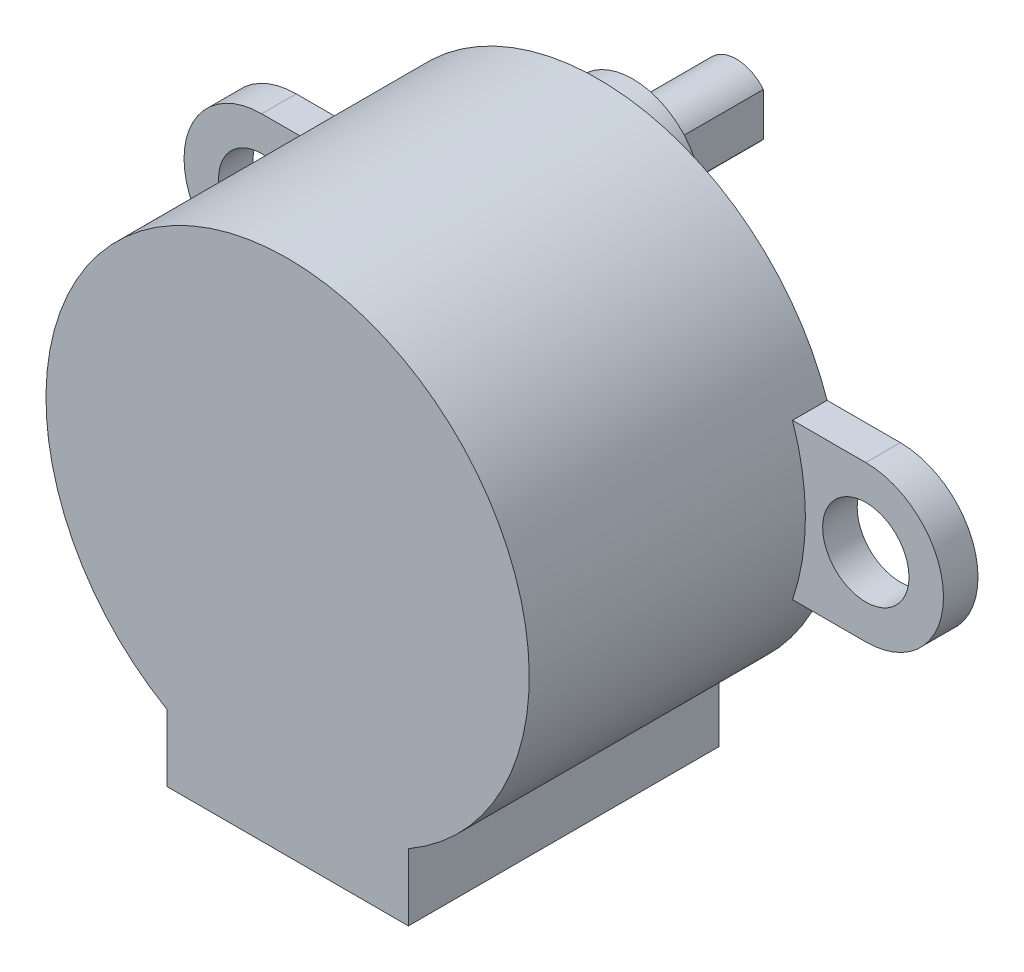
from build123d import *

# Parameters (mm, degrees)
CROQUIS1_R              = 14
SALIENTE_EXTRUIR1_DEPTH = 18
CROQUIS2_R              = 2.5
SALIENTE_EXTRUIR3_DEPTH = 2
SALIENTE_EXTRUIR4_DEPTH = 2
SALIENTE_EXTRUIR5_DEPTH = 6


with BuildPart() as part:
    # Croquis1 → Saliente-Extruir1 (new body)
    with BuildSketch(Plane.XY):
        Circle(CROQUIS1_R)
        with BuildLine():
            ThreePointArc((7, -12.124355653), (3.623466631, -13.522961568), (0, -14))
            Line((0, -14), (0, -16))
            Line((0, -16), (7, -16))
            Line((7, -16), (7, -12.124355653))
        make_face()
        with BuildLine():
            Line((0, -16), (0, -14))
            ThreePointArc((0, -14), (-3.623466631, -13.522961568), (-7, -12.124355653))
            Line((-7, -12.124355653), (-7, -16))
            Line((-7, -16), (0, -16))
        make_face()
    extrude(amount=SALIENTE_EXTRUIR1_DEPTH)

    # Croquis2 → Saliente-Extruir3 (add)
    # profile 1 of 2: a face of its own
    with BuildSketch(Plane(origin=(0, 0, 0), x_dir=(-1, 0, 0), z_dir=(0, 0, -1))):
        with BuildLine():
            Line((-17.5, 4.5), (-13.257073584, 4.5))
            ThreePointArc((-13.257073584, 4.5), (-14, 0), (-13.257073584, -4.5))
            Line((-13.257073584, -4.5), (-17.5, -4.5))
            ThreePointArc((-17.5, -4.5), (-22, 0), (-17.5, 4.5))
        make_face()
        with Locations((-17.5, 0)):
            Circle(CROQUIS2_R, mode=Mode.SUBTRACT)
    # profile 2 of 2: a face of its own
    with BuildSketch(Plane(origin=(0, 0, 0), x_dir=(-1, 0, 0), z_dir=(0, 0, -1))):
        with BuildLine():
            Line((17.5, -4.5), (13.257073584, -4.5))
            ThreePointArc((13.257073584, -4.5), (14, 0), (13.257073584, 4.5))
            Line((13.257073584, 4.5), (17.5, 4.5))
            ThreePointArc((17.5, 4.5), (22, 0), (17.5, -4.5))
        make_face()
        with Locations((17.5, 0)):
            Circle(CROQUIS2_R, mode=Mode.SUBTRACT)
    extrude(amount=-SALIENTE_EXTRUIR3_DEPTH)

    # Croquis3 → Saliente-Extruir4 (add)
    with BuildSketch(Plane(origin=(0, 0, 0), x_dir=(-1, 0, 0), z_dir=(0, 0, -1))):
        with BuildLine():
            ThreePointArc((4, 9), (2.828427125, 11.828427125), (0, 13))
            Line((0, 13), (0, 5))
            ThreePointArc((0, 5), (2.828427125, 6.171572875), (4, 9))
        make_face()
        with BuildLine():
            Line((0, 5), (0, 13))
            ThreePointArc((0, 13), (-4, 9), (0, 5))
        make_face()
    extrude(amount=SALIENTE_EXTRUIR4_DEPTH)

    # Croquis4 → Saliente-Extruir5 (add)
    with BuildSketch(Plane(origin=(0, 0, -2), x_dir=(-1, 0, 0), z_dir=(0, 0, -1))):
        with BuildLine():
            ThreePointArc((1.5612495, 10.25), (0, 11), (-1.5612495, 10.25))
            Line((-1.5612495, 10.25), (-1.5612495, 7.75))
            ThreePointArc((-1.5612495, 7.75), (0, 7), (1.5612495, 7.75))
            Line((1.5612495, 7.75), (1.5612495, 10.25))
        make_face()
    extrude(amount=SALIENTE_EXTRUIR5_DEPTH)


solid = part.part
